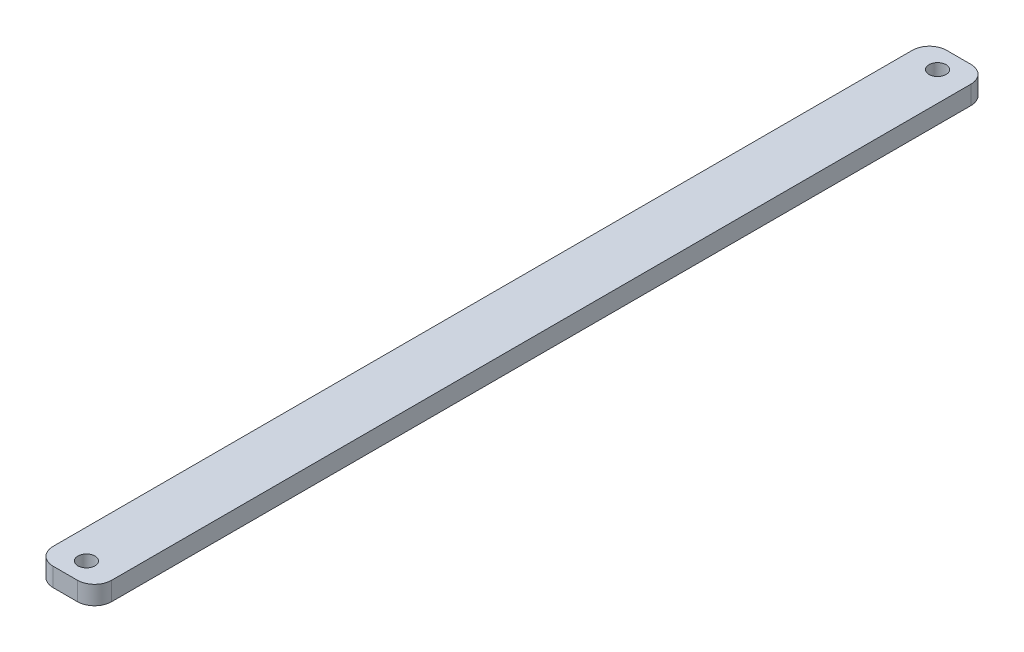
from build123d import *

# Parameters (mm, degrees)
SKETCH1_W           = 10
SKETCH1_H           = 152.4
SKETCH1_R           = 1.4605
BOSS_EXTRUDE1_DEPTH = 3.175
FILLET1_R           = 2.921


with BuildPart() as part:
    # Sketch1 → Boss-Extrude1 (new body)
    with BuildSketch(Plane(origin=(0, 0, 0), x_dir=(1, 0, 0), z_dir=(0, 1, 0))):
        Rectangle(SKETCH1_W, SKETCH1_H)
        with Locations(Location((0, 72.58, 0), (0, 0, 270))):
            Circle(SKETCH1_R, mode=Mode.SUBTRACT)
        with Locations(Location((0, -72.58, 0), (0, 0, 270))):
            Circle(SKETCH1_R, mode=Mode.SUBTRACT)
    extrude(amount=BOSS_EXTRUDE1_DEPTH)

    # Fillet1
    fillet1_edges = [part.edges().sort_by_distance(p)[0] for p in [
        (5, 1.5875, 76.2),
        (-5, 1.5875, 76.2),
        (-5, 1.5875, -76.2),
        (5, 1.5875, -76.2),
    ]]
    fillet(fillet1_edges, radius=FILLET1_R)


solid = part.part
